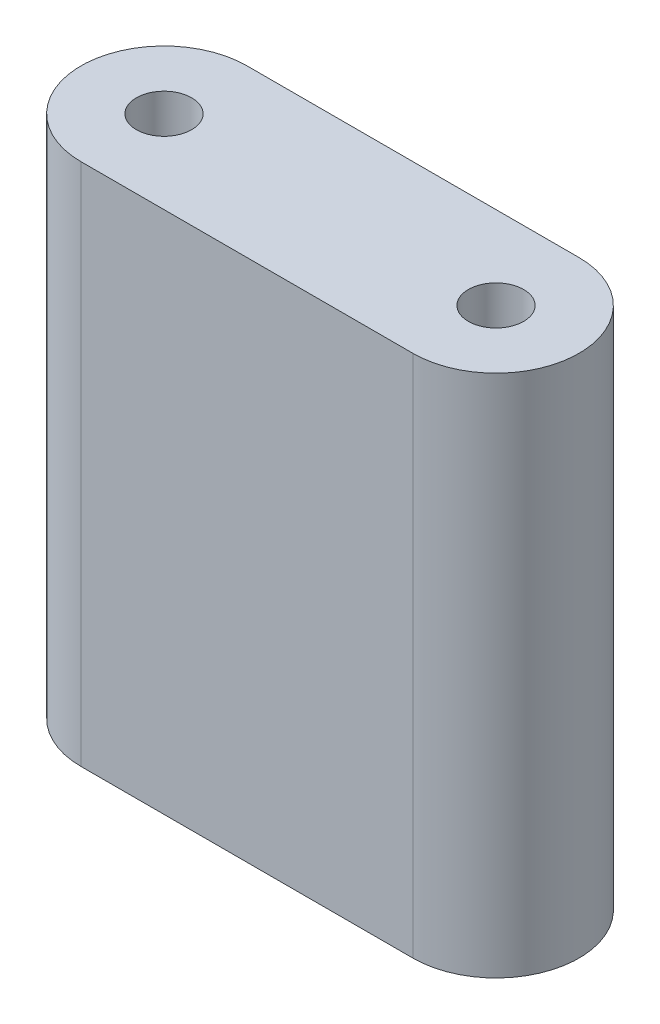
from build123d import *

# Parameters (mm, degrees)
SKETCH1_R           = 2
BOSS_EXTRUDE1_DEPTH = 37.86
CUT_EXTRUDE1_DEPTH  = 28.86


with BuildPart() as part:
    # Sketch1 → Boss-Extrude1 (new body)
    with BuildSketch(Plane(origin=(0, 0, 0), x_dir=(1, 0, 0), z_dir=(0, 1, 0))):
        with BuildLine():
            Line((-12, 6), (12, 6))
            ThreePointArc((12, 6), (18, 0), (12, -6))
            Line((12, -6), (-12, -6))
            ThreePointArc((-12, -6), (-18, 0), (-12, 6))
        make_face()
        with Locations(Location((-12, 0, 0), (0, 0, 270))):
            Circle(SKETCH1_R, mode=Mode.SUBTRACT)
        with Locations(Location((12, 0, 0), (0, 0, 270))):
            Circle(SKETCH1_R, mode=Mode.SUBTRACT)
    extrude(amount=BOSS_EXTRUDE1_DEPTH)

    # Sketch2 → Cut-Extrude1 (cut)
    with BuildSketch(Plane.XZ):
        Polygon((-13.833087105, 3.175), (-15.666174209, 0), (-13.833087105, -3.175), (-10.166912895, -3.175), (-8.333825791, 0), (-10.166912895, 3.175), align=None)
    cut_extrude1 = extrude(amount=-CUT_EXTRUDE1_DEPTH, mode=Mode.SUBTRACT)

    # Mirror1: Cut-Extrude1 across plane
    add(cut_extrude1.mirror(Plane(origin=(0, 0, 0), x_dir=(0, 0, 1), z_dir=(1, 0, 0))), mode=Mode.SUBTRACT)


solid = part.part
